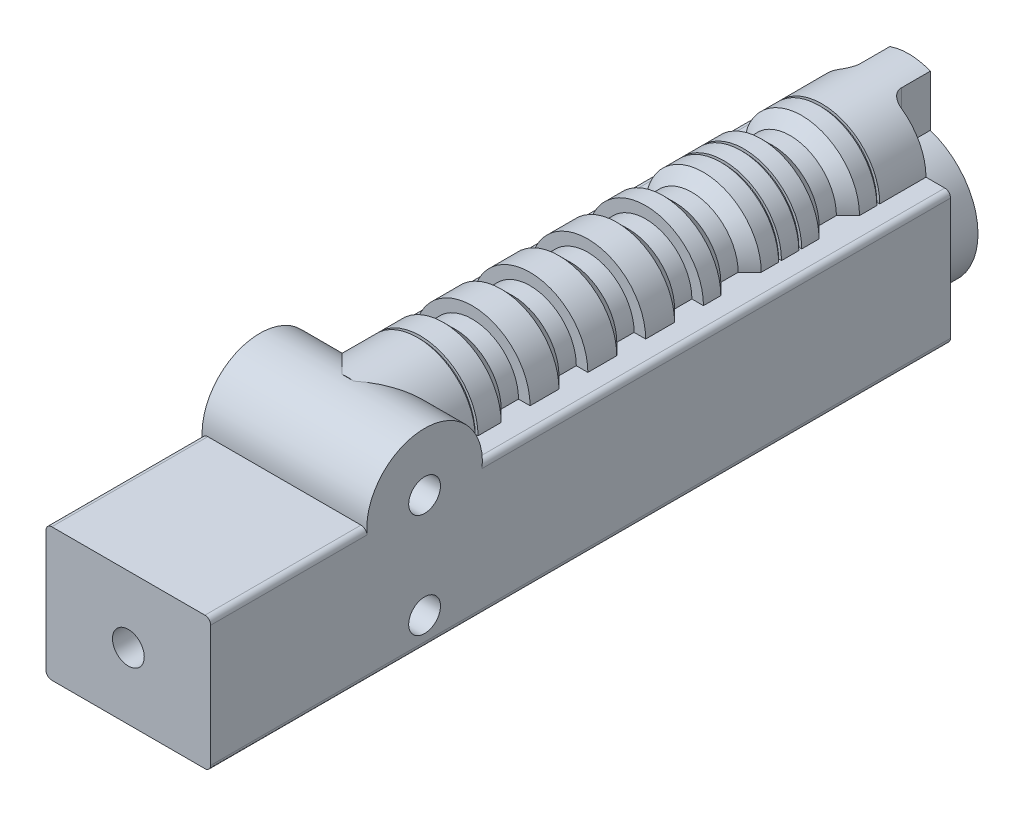
from build123d import *

# Parameters (mm, degrees)
SKETCH1_W                = 28.5
SKETCH1_H                = 23
CENTRE_BLOCK_DEPTH       = 128
TOP_CYLINDER_DEPTH       = 7
TOP_CYLINDER_DEPTH_BACK  = 90
CUT_REVOLVE2_ANGLE       = 180
NOSE_DEPTH               = 131.828370394
T_CROSS_REACH            = 134.885
SKETCH6_R                = 12
BARREL_DEPTH             = 7
SIDE_CYLINDER_DEPTH      = 128
CUT_REVOLVE1_ANGLE       = 180
SKETCH8_R                = 2.75
BACK_HOLE_DEPTH          = 5
SKETCH15_R               = 2.75
CUT_EXTRUDE6_DEPTH       = 10
FILLET2_R                = 1
SKETCH16_R               = 6.5
CUT_EXTRUDE7_DEPTH       = 20
SKETCH21_W               = 152.585030794
SKETCH21_H               = 42.838852891
CUT_EXTRUDE10_DEPTH      = 133.885289011
SKETCH23_R               = 2.75
CUT_EXTRUDE11_DEPTH      = 5
SKETCH24_R               = 2.75
BOTTOM_MOUNT_HOLES_DEPTH = 5


with BuildPart() as part:
    # Sketch1 → Centre block (new body)
    with BuildSketch(Plane.XY):
        Rectangle(SKETCH1_W, SKETCH1_H)
    extrude(amount=CENTRE_BLOCK_DEPTH)

    # Sketch3 → top cylinder (add, two sides: drawn at the far end of the back side and taken through both)
    with BuildSketch(Plane(origin=(0, 0, 0), x_dir=(-1, 0, 0), z_dir=(0, 0, -1)).offset(-TOP_CYLINDER_DEPTH_BACK)):
        with BuildLine():
            Line((-10, 11.5), (10, 11.5))
            ThreePointArc((10, 11.5), (0, 21.5), (-10, 11.5))
        make_face()
    extrude(amount=TOP_CYLINDER_DEPTH + TOP_CYLINDER_DEPTH_BACK)

    # Sketch9 → Cut-Revolve2 (revolve, cut)
    with BuildSketch(Plane(origin=(0, 11.5, 0), x_dir=(1, 0, 0), z_dir=(0, 1, 0))):
        Polygon((10, -78), (10, -81.888582416), (23.187071127, -81.888582416), (23.187071127, -74.052631606), (23.187071127, 0), (10, 0), (10, -8), (9.5, -8), (9.5, -8.5), (10, -8.5), (10, -11.5), (8, -13.5), (8, -16.5), (10, -18.5), (10, -21.5), (9.5, -21.5), (9.5, -22), (10, -22), (10, -25), (9.5, -25), (9.5, -25.5), (10, -25.5), (10, -28.5), (8, -30.5), (8, -33.5), (10, -35.5), (10, -38.5), (8, -38.5), (8, -41.5), (10, -43.5), (10, -48.5), (8, -48.5), (8, -51.5), (10, -53.5), (10, -58.5), (8, -58.5), (8, -60.3), (8, -61.5), (10, -63.5), (10, -68.5), (8, -68.5), (8, -70.3), (8, -71.5), (10, -73.5), (10, -74.052631606), (10, -77.5), (9.5, -77.5), (9.5, -78), align=None)
    revolve(axis=Axis((0, 11.5, -7), (0, 0, 1)), revolution_arc=CUT_REVOLVE2_ANGLE, mode=Mode.SUBTRACT)

    # Sketch4 → nose (cut, through all)
    with BuildSketch(Plane.XZ.offset(-11.5)):
        with BuildLine():
            Line((-3.25, -7), (-3.25, -2))
            ThreePointArc((-3.25, -2), (-3.835786438, -0.585786438), (-5.25, 0))
            Line((-5.25, 0), (-10, 0))
            Line((-10, 0), (-10, -7))
            Line((-10, -7), (-3.25, -7))
        make_face()
        with BuildLine():
            Line((3.75, -7), (3.75, -2))
            ThreePointArc((3.75, -2), (4.335786438, -0.585786438), (5.75, 0))
            Line((5.75, 0), (10, 0))
            Line((10, 0), (10, -7))
            Line((10, -7), (3.75, -7))
        make_face()
    extrude(amount=-NOSE_DEPTH, mode=Mode.SUBTRACT)

    # t cross: up to this face of the body (flat: up to its plane)
    t_cross_end = Plane(part.part.faces().sort_by_distance((-14.25, 0, 64))[0])
    # Sketch5 → t cross (add, up to the picked face)
    with BuildSketch(Plane(origin=(14.25, 0, 0), x_dir=(0, 0, -1), z_dir=(1, 0, 0)), mode=Mode.PRIVATE) as t_cross_sk1:
        with BuildLine():
            Line((-101, 11.5), (-81, 11.5))
            ThreePointArc((-81, 11.5), (-91, 21.5), (-101, 11.5))
        make_face()
    t_cross_tool1 = split(extrude(t_cross_sk1.sketch, amount=-T_CROSS_REACH, mode=Mode.PRIVATE), bisect_by=t_cross_end, keep=Keep.BOTH, mode=Mode.PRIVATE)
    add(t_cross_tool1.solids().sort_by(Axis((14.25, 15.744132, 91), (-1, 0, 0)))[0])

    # Sketch6 → Barrel (add)
    with BuildSketch(Plane(origin=(0, 0, 0), x_dir=(-1, 0, 0), z_dir=(0, 0, -1))):
        with Locations((0, 0.5)):
            Circle(SKETCH6_R)
    extrude(amount=BARREL_DEPTH)

    # Sketch2 → side cylinder (add)
    with BuildSketch(Plane(origin=(0, 0, 0), x_dir=(-1, 0, 0), z_dir=(0, 0, -1))):
        with BuildLine():
            Line((14.25, 10), (14.25, -10))
            ThreePointArc((14.25, -10), (24.25, 0), (14.25, 10))
        make_face()
    extrude(amount=-SIDE_CYLINDER_DEPTH)

    # Sketch7 → Cut-Revolve1 (revolve, cut)
    with BuildSketch(Plane(origin=(-14.25, 0, 0), x_dir=(0, 0, -1), z_dir=(1, 0, 0))):
        Polygon((-51, -10), (-51, -9), (-51.5, -9), (-51.5, -10), (-55.5, -10), (-57.5, -8), (-58.77482941, -8), (-60.5, -8), (-60.5, -10), (-64.5, -10), (-66.5, -8), (-67.77482941, -8), (-69.5, -8), (-69.5, -10), (-73.5, -10), (-75.5, -8), (-76.77482941, -8), (-78.5, -8), (-78.5, -10), (-82.5, -10), (-84.5, -8), (-85.77482941, -8), (-87.5, -8), (-87.5, -10), (-91.5, -10), (-93.5, -8), (-94.77482941, -8), (-96.5, -8), (-96.5, -10), (-100.5, -10), (-102.5, -8), (-105.5, -8), (-107.5, -10), (-110.5, -10), (-110.5, -9), (-111, -9), (-111, -10), (-114, -10), (-114, -9), (-114.5, -9), (-114.5, -10), (-117.5, -10), (-119.5, -8), (-122.65, -8), (-124.65, -10), (-124.65, -14.812383498), (-117.5, -14.812383498), (0, -14.812383498), (0, -10), align=None)
    revolve(axis=Axis((-14.25, 0, 135.382259058), (0, 0, -1)), revolution_arc=CUT_REVOLVE1_ANGLE, mode=Mode.SUBTRACT)

    # Sketch8 → Back hole (cut)
    with BuildSketch(Plane.XY.offset(128)):
        Circle(SKETCH8_R)
    extrude(amount=-BACK_HOLE_DEPTH, mode=Mode.SUBTRACT)

    # Sketch15 → Cut-Extrude6 (cut)
    with BuildSketch(Plane(origin=(14.25, 0, 0), x_dir=(0, 0, -1), z_dir=(1, 0, 0))):
        with Locations((-91, 11.5)):
            Circle(SKETCH15_R)
        with Locations((-91, -6.5)):
            Circle(SKETCH15_R)
    extrude(amount=-CUT_EXTRUDE6_DEPTH, mode=Mode.SUBTRACT)

    # Fillet2
    fillet2_edges = [part.edges().sort_by_distance(p)[0] for p in [
        (-14.25, 11.5, 40.5),
        (14.25, 11.5, 40.5),
        (14.25, -11.5, 64),
        (-14.25, -11.5, 64),
        (-14.25, 11.5, 114.5),
        (14.25, 11.5, 114.5),
    ]]
    fillet(fillet2_edges, radius=FILLET2_R)

    # Sketch16 → Cut-Extrude7 (cut)
    with BuildSketch(Plane(origin=(0, 0, -7), x_dir=(-1, 0, 0), z_dir=(0, 0, -1))):
        Circle(SKETCH16_R)
    extrude(amount=-CUT_EXTRUDE7_DEPTH, mode=Mode.SUBTRACT)

    # Sketch21 → Cut-Extrude10 (cut, through all)
    with BuildSketch(Plane.ZY.offset(14.25)):
        with Locations((64.09795532, 3.365381731)):
            Rectangle(SKETCH21_W, SKETCH21_H)
    extrude(amount=CUT_EXTRUDE10_DEPTH, mode=Mode.SUBTRACT)

    # Sketch23 → Cut-Extrude11 (cut)
    with BuildSketch(Plane.ZY.offset(14.25)):
        with Locations((10, 0)):
            Circle(SKETCH23_R)
        with Locations((118, 0)):
            Circle(SKETCH23_R)
        with Locations((64, 0)):
            Circle(SKETCH23_R)
    extrude(amount=-CUT_EXTRUDE11_DEPTH, mode=Mode.SUBTRACT)

    # Sketch24 → Bottom Mount Holes (cut)
    with BuildSketch(Plane.XZ.offset(11.5)):
        with Locations(Location((0, 20, 0), (0, 0, 270))):
            Circle(SKETCH24_R)
        with Locations(Location((0, 90, 0), (0, 0, 270))):
            Circle(SKETCH24_R)
    extrude(amount=-BOTTOM_MOUNT_HOLES_DEPTH, mode=Mode.SUBTRACT)


solid = part.part
